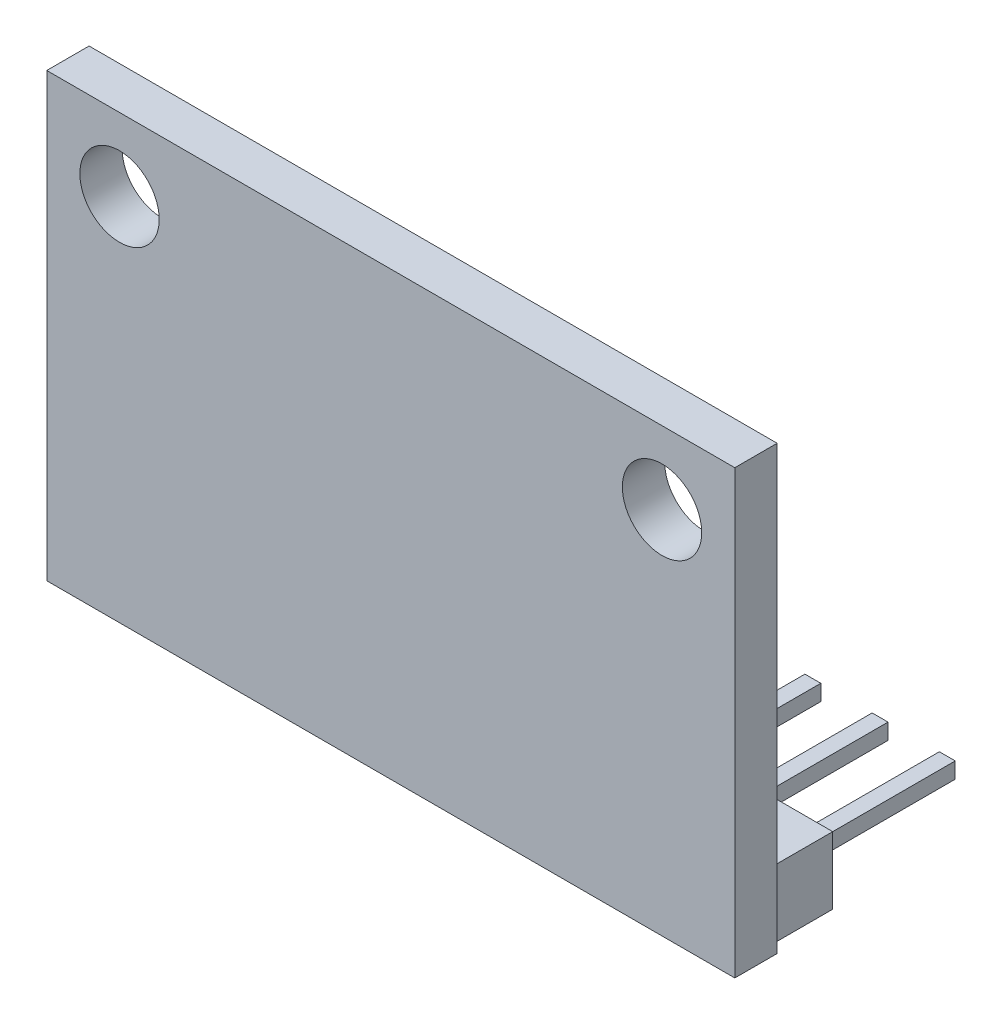
from build123d import *

# Parameters (mm, degrees)
SKIZZE1_W                          = 26
SKIZZE1_H                          = 16.7
SKIZZE1_R                          = 1.5
AUFSATZ_LINEAR_AUSTRAGEN1_DEPTH    = 1.6
SKIZZE3_W                          = 25.4
SKIZZE3_H                          = 2.54
AUFSATZ_LINEAR_AUSTRAGEN2_DEPTH    = 2.4
SKIZZE4_W                          = 0.6
SKIZZE4_H                          = 0.6
AUFSATZ_LINEAR_AUSTRAGEN3_DEPTH    = 5.6
AUFSATZ_LINEAR_AUSTRAGEN3_2_DEPTH  = 5.6
AUFSATZ_LINEAR_AUSTRAGEN3_3_DEPTH  = 5.6
AUFSATZ_LINEAR_AUSTRAGEN3_4_DEPTH  = 5.6
AUFSATZ_LINEAR_AUSTRAGEN3_5_DEPTH  = 5.6
AUFSATZ_LINEAR_AUSTRAGEN3_6_DEPTH  = 5.6
AUFSATZ_LINEAR_AUSTRAGEN3_7_DEPTH  = 5.6
AUFSATZ_LINEAR_AUSTRAGEN3_8_DEPTH  = 5.6
AUFSATZ_LINEAR_AUSTRAGEN3_9_DEPTH  = 5.6
AUFSATZ_LINEAR_AUSTRAGEN3_10_DEPTH = 5.6


with BuildPart() as part:
    # Skizze1 → Aufsatz-Linear austragen1 (new body)
    with BuildSketch(Plane.XY):
        Rectangle(SKIZZE1_W, SKIZZE1_H)
        with Locations((-10.25, 5.6)):
            Circle(SKIZZE1_R, mode=Mode.SUBTRACT)
        with Locations((10.25, 5.6)):
            Circle(SKIZZE1_R, mode=Mode.SUBTRACT)
    extrude(amount=AUFSATZ_LINEAR_AUSTRAGEN1_DEPTH)


with BuildPart() as body_2:
    # Skizze3 → Aufsatz-Linear austragen2 (new body)
    with BuildSketch(Plane(origin=(0, 0, 0), x_dir=(-1, 0, 0), z_dir=(0, 0, -1))):
        with Locations((0, -6.98)):
            Rectangle(SKIZZE3_W, SKIZZE3_H)
    extrude(amount=AUFSATZ_LINEAR_AUSTRAGEN2_DEPTH)


with BuildPart() as body_3:
    # Skizze4 → Aufsatz-Linear austragen3 (new body)
    with BuildSketch(Plane(origin=(0, 0, -2.4), x_dir=(-1, 0, 0), z_dir=(0, 0, -1))):
        with Locations((-11.43, -6.98)):
            Rectangle(SKIZZE4_W, SKIZZE4_H)
    extrude(amount=AUFSATZ_LINEAR_AUSTRAGEN3_DEPTH)


with BuildPart() as body_4:
    # Skizze4 → Aufsatz-Linear austragen3 2 (new body)
    with BuildSketch(Plane(origin=(0, 0, -2.4), x_dir=(-1, 0, 0), z_dir=(0, 0, -1))):
        with Locations((-8.89, -6.98)):
            Rectangle(SKIZZE4_W, SKIZZE4_H)
    extrude(amount=AUFSATZ_LINEAR_AUSTRAGEN3_2_DEPTH)


with BuildPart() as body_5:
    # Skizze4 → Aufsatz-Linear austragen3 3 (new body)
    with BuildSketch(Plane(origin=(0, 0, -2.4), x_dir=(-1, 0, 0), z_dir=(0, 0, -1))):
        with Locations((-6.35, -6.98)):
            Rectangle(SKIZZE4_W, SKIZZE4_H)
    extrude(amount=AUFSATZ_LINEAR_AUSTRAGEN3_3_DEPTH)


with BuildPart() as body_6:
    # Skizze4 → Aufsatz-Linear austragen3 4 (new body)
    with BuildSketch(Plane(origin=(0, 0, -2.4), x_dir=(-1, 0, 0), z_dir=(0, 0, -1))):
        with Locations((-3.81, -6.98)):
            Rectangle(SKIZZE4_W, SKIZZE4_H)
    extrude(amount=AUFSATZ_LINEAR_AUSTRAGEN3_4_DEPTH)


with BuildPart() as body_7:
    # Skizze4 → Aufsatz-Linear austragen3 5 (new body)
    with BuildSketch(Plane(origin=(0, 0, -2.4), x_dir=(-1, 0, 0), z_dir=(0, 0, -1))):
        with Locations((-1.27, -6.98)):
            Rectangle(SKIZZE4_W, SKIZZE4_H)
    extrude(amount=AUFSATZ_LINEAR_AUSTRAGEN3_5_DEPTH)


with BuildPart() as body_8:
    # Skizze4 → Aufsatz-Linear austragen3 6 (new body)
    with BuildSketch(Plane(origin=(0, 0, -2.4), x_dir=(-1, 0, 0), z_dir=(0, 0, -1))):
        with Locations((1.27, -6.98)):
            Rectangle(SKIZZE4_W, SKIZZE4_H)
    extrude(amount=AUFSATZ_LINEAR_AUSTRAGEN3_6_DEPTH)


with BuildPart() as body_9:
    # Skizze4 → Aufsatz-Linear austragen3 7 (new body)
    with BuildSketch(Plane(origin=(0, 0, -2.4), x_dir=(-1, 0, 0), z_dir=(0, 0, -1))):
        with Locations((3.81, -6.98)):
            Rectangle(SKIZZE4_W, SKIZZE4_H)
    extrude(amount=AUFSATZ_LINEAR_AUSTRAGEN3_7_DEPTH)


with BuildPart() as body_10:
    # Skizze4 → Aufsatz-Linear austragen3 8 (new body)
    with BuildSketch(Plane(origin=(0, 0, -2.4), x_dir=(-1, 0, 0), z_dir=(0, 0, -1))):
        with Locations((6.35, -6.98)):
            Rectangle(SKIZZE4_W, SKIZZE4_H)
    extrude(amount=AUFSATZ_LINEAR_AUSTRAGEN3_8_DEPTH)


with BuildPart() as body_11:
    # Skizze4 → Aufsatz-Linear austragen3 9 (new body)
    with BuildSketch(Plane(origin=(0, 0, -2.4), x_dir=(-1, 0, 0), z_dir=(0, 0, -1))):
        with Locations((8.89, -6.98)):
            Rectangle(SKIZZE4_W, SKIZZE4_H)
    extrude(amount=AUFSATZ_LINEAR_AUSTRAGEN3_9_DEPTH)


with BuildPart() as body_12:
    # Skizze4 → Aufsatz-Linear austragen3 10 (new body)
    with BuildSketch(Plane(origin=(0, 0, -2.4), x_dir=(-1, 0, 0), z_dir=(0, 0, -1))):
        with Locations((11.43, -6.98)):
            Rectangle(SKIZZE4_W, SKIZZE4_H)
    extrude(amount=AUFSATZ_LINEAR_AUSTRAGEN3_10_DEPTH)


solid = Compound([part.part, body_2.part, body_3.part, body_4.part, body_5.part, body_6.part, body_7.part, body_8.part, body_9.part, body_10.part, body_11.part, body_12.part])
